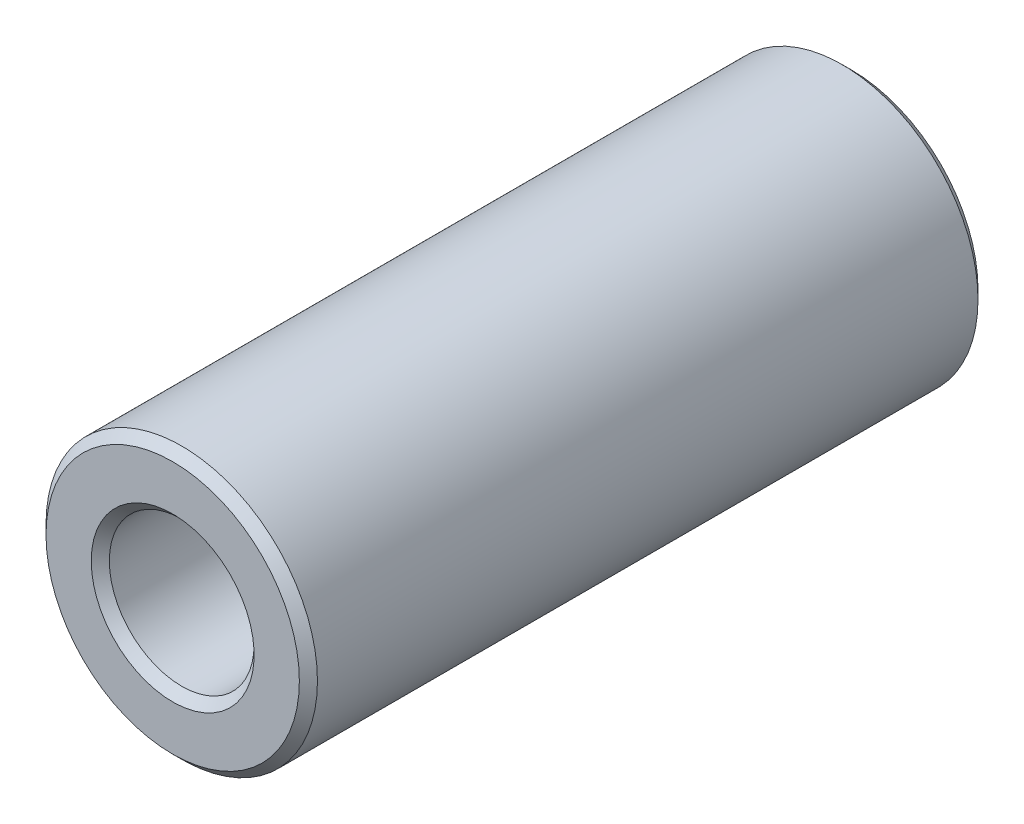
from build123d import *

# Parameters (mm, degrees)
SKETCH_1_W     = 15
SKETCH_1_H     = 1.4
CHAMFER_1_SIZE = 0.2


with BuildPart() as part:
    # ｽｹｯﾁ1 → 回転1 (revolve)
    with BuildSketch(Plane(origin=(0, 0, 0), x_dir=(0, 0, -1), z_dir=(1, 0, 0)), mode=Mode.PRIVATE) as revolve_1_sk:
        with Locations((0, 2.3)):
            Rectangle(SKETCH_1_W, SKETCH_1_H)
    revolve(revolve_1_sk.sketch.rotate(Axis((0, 0, 7.128099174), (0, 0, -1)), 90), axis=Axis((0, 0, 7.128099174), (0, 0, -1)))

    # 面取り1
    chamfer_1_edges = [part.edges().sort_by_distance(p)[0] for p in [
        (-3, 0, 7.5),
        (-3, 0, -7.5),
        (-1.6, 0, -7.5),
        (-1.6, 0, 7.5),
    ]]
    chamfer(chamfer_1_edges, length=CHAMFER_1_SIZE)


solid = part.part
